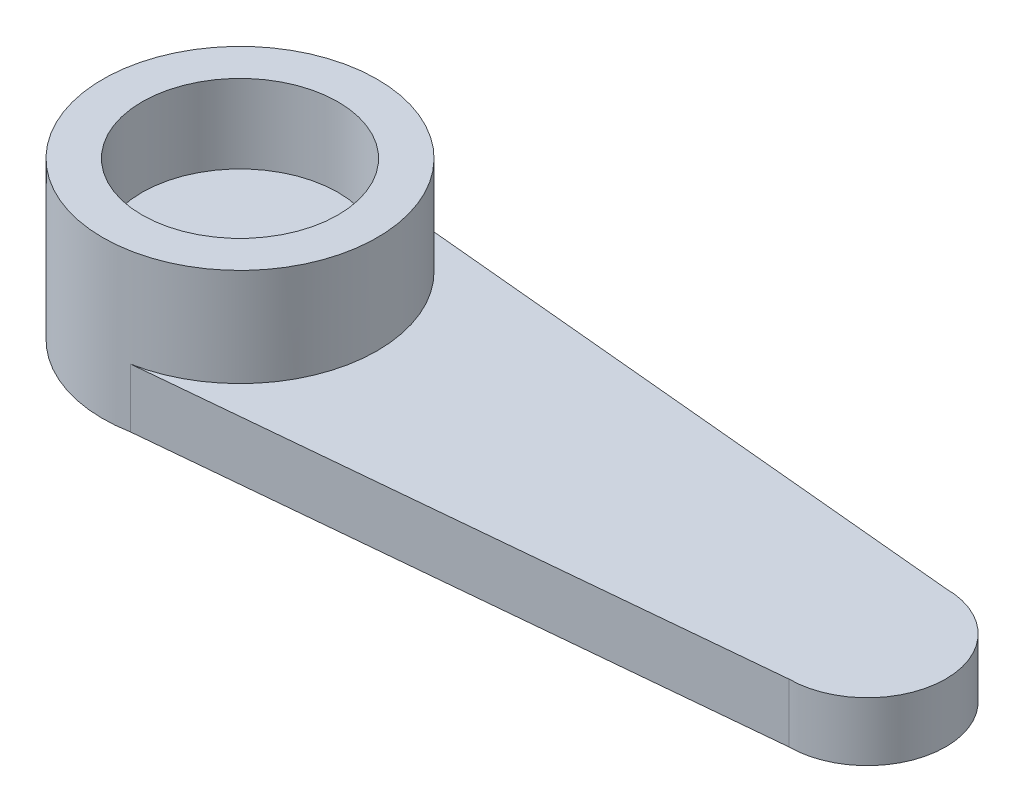
from build123d import *

# Parameters (mm, degrees)
SKETCH1_R           = 3.5
BOSS_EXTRUDE1_DEPTH = 4
SKETCH2_R           = 2.5
CUT_EXTRUDE1_DEPTH  = 2
SKETCH3_R           = 2
BOSS_EXTRUDE2_DEPTH = 1.5


with BuildPart() as part:
    # Sketch1 → Boss-Extrude1 (new body)
    with BuildSketch(Plane(origin=(0, 0, 0), x_dir=(1, 0, 0), z_dir=(0, 1, 0))):
        with Locations(Location((0, 0, 0), (0, 0, 270))):
            Circle(SKETCH1_R)
    extrude(amount=BOSS_EXTRUDE1_DEPTH)

    # Sketch2 → Cut-Extrude1 (cut)
    with BuildSketch(Plane(origin=(0, 4, 0), x_dir=(1, 0, 0), z_dir=(0, 1, 0))):
        with Locations(Location((0, 0, 0), (0, 0, 270))):
            Circle(SKETCH2_R)
    extrude(amount=-CUT_EXTRUDE1_DEPTH, mode=Mode.SUBTRACT)

    # Sketch3 → Boss-Extrude2 (add)
    with BuildSketch(Plane(origin=(0, 0, 0), x_dir=(1, 0, 0), z_dir=(0, 1, 0))):
        with Locations((16, 0)):
            Circle(SKETCH3_R)
        with BuildLine():
            Line((16, 2), (0.65053243, 3.439012585))
            ThreePointArc((0.65053243, 3.439012585), (2.695075463, 2.233062527), (3.5, 0))
            ThreePointArc((3.5, 0), (2.695075463, -2.233062527), (0.65053243, -3.439012585))
            Line((0.65053243, -3.439012585), (16, -2))
            ThreePointArc((16, -2), (14, 0), (16, 2))
        make_face()
    extrude(amount=BOSS_EXTRUDE2_DEPTH)


solid = part.part
